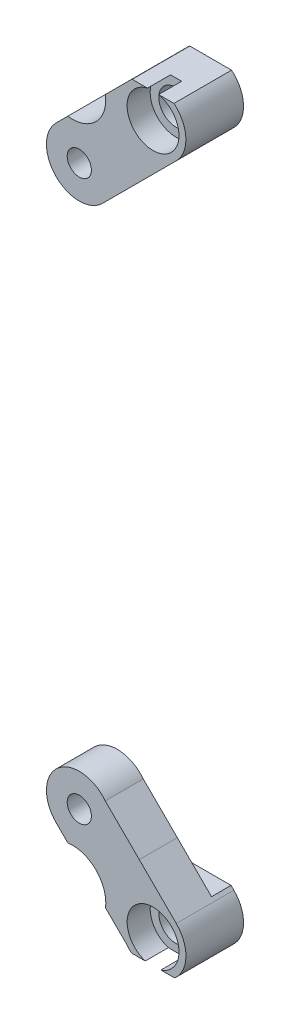
from build123d import *

# Parameters (mm, degrees)
SKIZZE8_R                       = 1.5
SKIZZE8_R_2                     = 1.05
AUFSATZ_LINEAR_AUSTRAGEN2_DEPTH = 5
SKIZZE10_W                      = 20.065556473
SKIZZE10_H                      = 56.862731781
SCHNITT_LINEAR_AUSTRAGEN6_DEPTH = 1.7
SKIZZE11_R                      = 2.25
SCHNITT_LINEAR_AUSTRAGEN7_DEPTH = 2


with BuildPart() as part:
    # Skizze8 → Aufsatz-Linear austragen2 (new body)
    # profile 1 of 4: a face of its own
    with BuildSketch(Plane.XY):
        with BuildLine():
            ThreePointArc((-47.123867598, -24.649552882), (-48.874309678, -27.278901163), (-51.975427164, -26.678409532))
            Line((-51.975427164, -26.678409532), (-50.970278136, -27.676773969))
            ThreePointArc((-50.970278136, -27.676773969), (-48.530213724, -28.49201094), (-47.698469834, -30.926498104))
            Line((-47.698469834, -30.926498104), (-45.856507051, -32.756027941))
            ThreePointArc((-45.856507051, -32.756027941), (-45.664613255, -32.986375692), (-45.449583337, -33.195290626))
            Line((-45.449583337, -33.195290626), (-41.698151858, -33.195290626))
            ThreePointArc((-41.698151858, -33.195290626), (-40.725381252, -31.142426674), (-41.562362318, -29.03055647))
            Line((-41.562362318, -29.03055647), (-44.770198206, -25.834622697))
            Line((-44.770198206, -25.834622697), (-47.721753605, -22.902989811))
            ThreePointArc((-47.721753605, -22.902989811), (-47.27747882, -23.72652116), (-47.123867598, -24.649552882))
        make_face()
        with Locations((-43.573867598, -31.049552882)):
            Circle(SKIZZE8_R, mode=Mode.SUBTRACT)
    # profile 2 of 4: a face of its own
    with BuildSketch(Plane.XY):
        with BuildLine():
            ThreePointArc((-52.823867598, -24.649552882), (-52.603215878, -25.749110802), (-51.975427164, -26.678409532))
            ThreePointArc((-51.975427164, -26.678409532), (-48.874309678, -27.278901163), (-47.123867598, -24.649552882))
            ThreePointArc((-47.123867598, -24.649552882), (-47.27747882, -23.72652116), (-47.721753605, -22.902989811))
            ThreePointArc((-47.721753605, -22.902989811), (-50.89689932, -21.953164105), (-52.823867598, -24.649552882))
        make_face()
        with Locations((-49.973867598, -24.649552882)):
            Circle(SKIZZE8_R_2, mode=Mode.SUBTRACT)
    # profile 3 of 4: a face of its own
    with BuildSketch(Plane.XY):
        with BuildLine():
            Line((-50.979721106, 26.915100263), (-51.992527433, 25.902293935))
            ThreePointArc((-51.992527433, 25.902293935), (-48.885473472, 26.524330713), (-47.123944687, 23.890373535))
            ThreePointArc((-47.123944687, 23.890373535), (-47.328564647, 22.829965856), (-47.913042545, 21.921825248))
            Line((-47.913042545, 21.921825248), (-44.780724925, 25.053084596))
            Line((-44.780724925, 25.053084596), (-41.561819772, 28.270907976))
            ThreePointArc((-41.561819772, 28.270907976), (-40.729945685, 30.421733289), (-41.761957084, 32.48401758))
            Line((-41.761957084, 32.48401758), (-45.391504037, 32.48401758))
            Line((-45.391504037, 32.48401758), (-45.592527433, 32.302293935))
            Line((-45.592527433, 32.302293935), (-47.705333761, 30.189487608))
            ThreePointArc((-47.705333761, 30.189487608), (-48.526663441, 27.736429944), (-50.979721106, 26.915100263))
        make_face()
        with Locations((-43.576729265, 30.286498448)):
            Circle(SKIZZE8_R, mode=Mode.SUBTRACT)
    # profile 4 of 4: a face of its own
    with BuildSketch(Plane.XY):
        with BuildLine():
            ThreePointArc((-47.123944687, 23.890373535), (-48.885473472, 26.524330713), (-51.992527433, 25.902293935))
            ThreePointArc((-51.992527433, 25.902293935), (-52.607901865, 24.978844751), (-52.823944687, 23.890373535))
            ThreePointArc((-52.823944687, 23.890373535), (-51.095132106, 21.270175304), (-48.006092917, 21.828806313))
            Line((-48.006092917, 21.828806313), (-47.913042545, 21.921825248))
            ThreePointArc((-47.913042545, 21.921825248), (-47.328564647, 22.829965856), (-47.123944687, 23.890373535))
        make_face()
        with Locations((-49.973944687, 23.890373535)):
            Circle(SKIZZE8_R_2, mode=Mode.SUBTRACT)
    extrude(amount=AUFSATZ_LINEAR_AUSTRAGEN2_DEPTH)

    # Skizze10 → Schnitt-Linear austragen6 (cut)
    with BuildSketch(Plane(origin=(0, 0, 0), x_dir=(-1, 0, 0), z_dir=(0, 0, -1))):
        with Locations((47.275807156, -0.357800275)):
            Rectangle(SKIZZE10_W, SKIZZE10_H)
    extrude(amount=-SCHNITT_LINEAR_AUSTRAGEN6_DEPTH, mode=Mode.SUBTRACT)

    # Skizze11 → Schnitt-Linear austragen7 (cut)
    with BuildSketch(Plane.XY.offset(5)):
        with Locations((-43.576729265, 30.286498448)):
            Circle(SKIZZE11_R)
        with Locations((-43.573867598, -31.049552882)):
            Circle(SKIZZE11_R)
    extrude(amount=-SCHNITT_LINEAR_AUSTRAGEN7_DEPTH, mode=Mode.SUBTRACT)


solid = part.part
